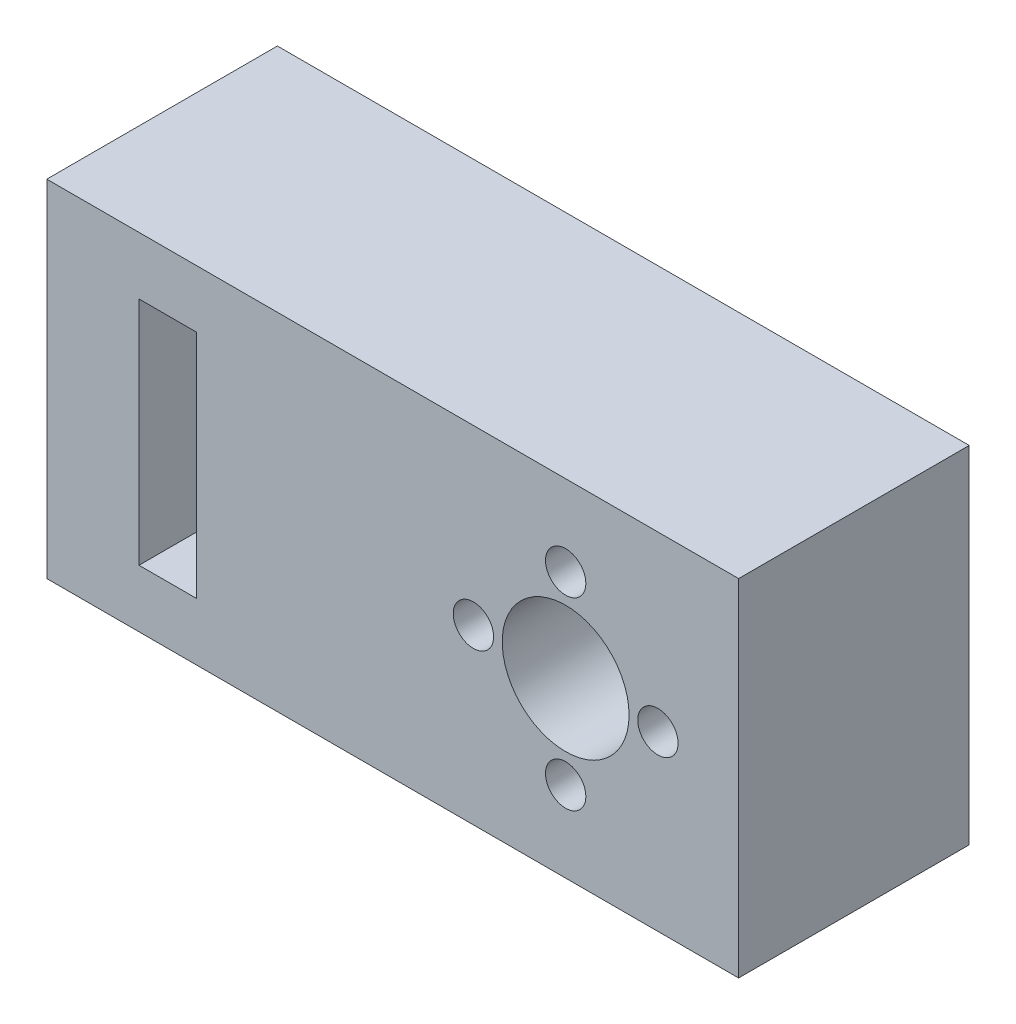
from build123d import *

# Parameters (mm, degrees)
SKETCH1_W           = 60
SKETCH1_H           = 30
SKETCH1_R           = 5.5
SKETCH1_R_2         = 1.75
SKETCH1_W_2         = 5
SKETCH1_H_2         = 20
BOSS_EXTRUDE1_DEPTH = 10
SKETCH2_R           = 2.5
CUT_EXTRUDE1_DEPTH  = 8


with BuildPart() as part:
    # Sketch1 → Boss-Extrude1 (new, symmetric)
    with BuildSketch(Plane.XY):
        Rectangle(SKETCH1_W, SKETCH1_H)
        with Locations((15, 0)):
            Circle(SKETCH1_R, mode=Mode.SUBTRACT)
        with Locations((15, 8)):
            Circle(SKETCH1_R_2, mode=Mode.SUBTRACT)
        with Locations((23, 0)):
            Circle(SKETCH1_R_2, mode=Mode.SUBTRACT)
        with Locations((15, -8)):
            Circle(SKETCH1_R_2, mode=Mode.SUBTRACT)
        with Locations((7, 0)):
            Circle(SKETCH1_R_2, mode=Mode.SUBTRACT)
        with Locations((-19.5, 0)):
            Rectangle(SKETCH1_W_2, SKETCH1_H_2, mode=Mode.SUBTRACT)
    extrude(amount=BOSS_EXTRUDE1_DEPTH, both=True)

    # Sketch2 → Cut-Extrude1 (cut)
    with BuildSketch(Plane.ZY.offset(30)):
        with Locations(Location((0, 0, 0), (0, 0, 270))):
            Circle(SKETCH2_R)
    extrude(amount=-CUT_EXTRUDE1_DEPTH, mode=Mode.SUBTRACT)


solid = part.part
